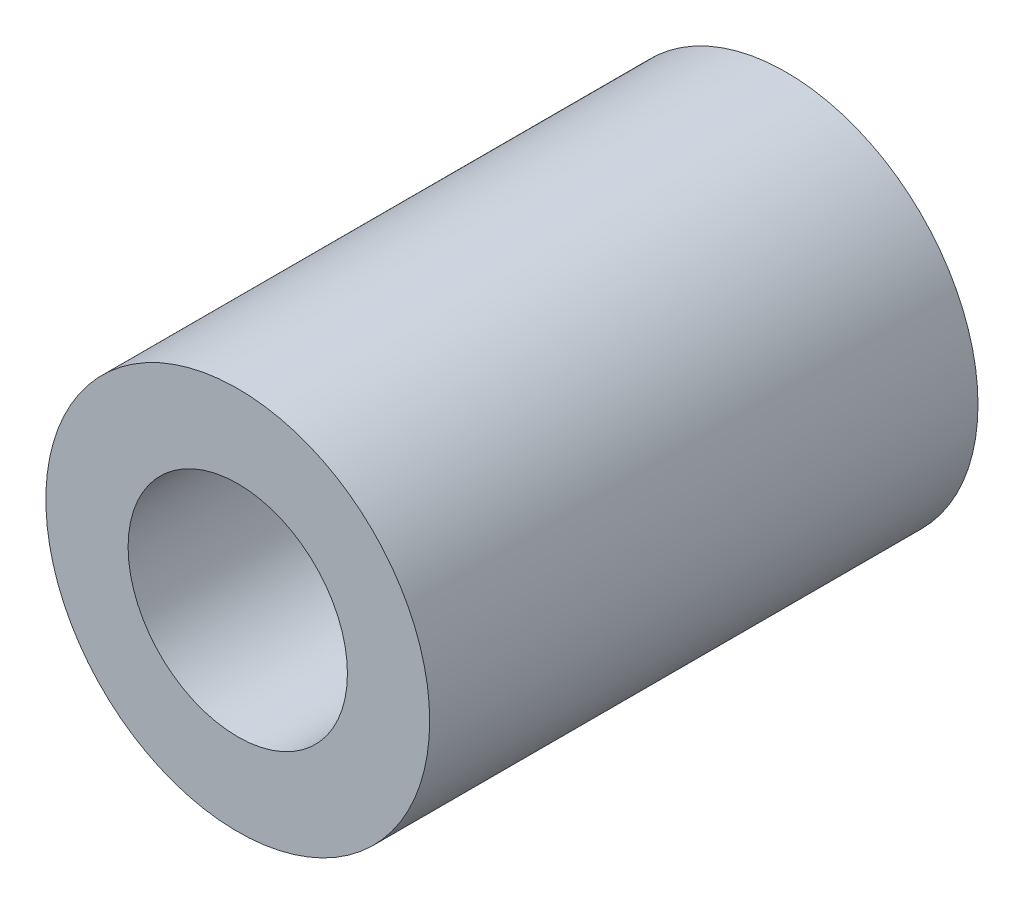
from build123d import *

# Parameters (mm, degrees)
SKETCH_1_R      = 3.5
SKETCH_1_R_2    = 2
EXTRUDE_1_DEPTH = 10


with BuildPart() as part:
    # 草图1 → 凸台-拉伸1 (new body)
    with BuildSketch(Plane.XY):
        Circle(SKETCH_1_R)
        Circle(SKETCH_1_R_2, mode=Mode.SUBTRACT)
    extrude(amount=EXTRUDE_1_DEPTH)


solid = part.part
